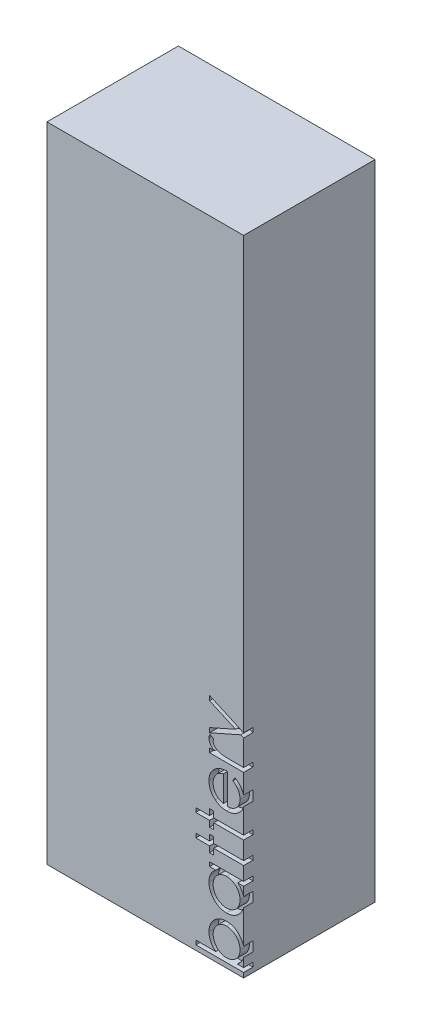
from build123d import *

# Parameters (mm, degrees)
SKETCH_1_W          = 42.2
SKETCH_1_H          = 138
EXTRUDE_1_DEPTH     = 28.2
CUT_EXTRUDE_1_DEPTH = 2


with BuildPart() as part:
    # 草图1 → 凸台-拉伸1 (new body)
    with BuildSketch(Plane.XY):
        with Locations((21.1, -69)):
            Rectangle(SKETCH_1_W, SKETCH_1_H)
    extrude(amount=EXTRUDE_1_DEPTH)

    # 草图2 → 切除-拉伸1 (cut)
    # profile 1 of 7: a face of its own
    with BuildSketch(Plane.XY.offset(28.2)):
        with BuildLine():
            Line((42.2, -136.974358974), (31.943589744, -136.974358974))
            Line((31.943589744, -136.974358974), (31.943589744, -136.076923077))
            Line((31.943589744, -136.076923077), (36.218429487, -136.076923077))
            add(Edge.make_bspline(
                [(36.218429487, -136.076923077), (36.101978253, -135.975799023), (35.874777095, -135.778501824), (35.578069524, -135.447711964), (35.326491018, -135.100838908), (35.119102108, -134.735243891), (34.961177516, -134.350406939), (34.845684974, -133.9483152), (34.776008108, -133.527940798), (34.768105042, -133.241314587), (34.764102564, -133.096153846)],
                knots=[0, 0, 0, 0, 1.077089805, 2.101446609, 3.097517232, 4.067117542, 5.031729543, 5.997785507, 6.985986182, 8, 8, 8, 8], degree=3))
            add(Edge.make_bspline(
                [(34.764102564, -133.096153846), (34.767646073, -132.967107738), (34.774652195, -132.71196159), (34.82789361, -132.336869741), (34.914230187, -131.975974669), (35.033922128, -131.629472818), (35.192730634, -131.298981011), (35.382848656, -130.981669419), (35.609243883, -130.679163749), (35.868096199, -130.396149791), (36.149115121, -130.135310116), (36.449630308, -129.906988658), (36.765273423, -129.714132384), (37.094987887, -129.554614404), (37.440120319, -129.431268539), (37.800332315, -129.346290633), (38.175269511, -129.292309306), (38.43044895, -129.285508603), (38.560176282, -129.282051282)],
                knots=[0, 0, 0, 0, 1.034377878, 2.045141349, 3.03070803, 4.00595497, 4.978199603, 5.965204761, 6.967410914, 8.002051993, 9.036360596, 10.037508045, 11.022711142, 11.997267194, 12.969246472, 13.954813154, 14.960274251, 16, 16, 16, 16], degree=3))
            add(Edge.make_bspline(
                [(38.560176282, -129.282051282), (38.687890618, -129.285583969), (38.939723176, -129.292549872), (39.310313337, -129.34575361), (39.666995335, -129.43360008), (40.008847498, -129.559203461), (40.337475822, -129.717103286), (40.64913412, -129.914564073), (40.949245479, -130.1425955), (41.22817014, -130.406398782), (41.485979854, -130.691866076), (41.709996612, -130.997335341), (41.903474098, -131.31511226), (42.056775377, -131.650149724), (42.180778009, -131.997486985), (42.266828554, -132.360845233), (42.317037283, -132.738168742), (42.324453189, -132.994508423), (42.328205128, -133.124198718)],
                knots=[0, 0, 0, 0, 1.024244038, 2.01964794, 2.996620209, 3.965911562, 4.936179293, 5.91563013, 6.920572822, 7.955171681, 8.990768464, 10.002129126, 10.989675881, 11.969873457, 12.952483066, 13.943799762, 14.959703725, 16, 16, 16, 16], degree=3))
            add(Edge.make_bspline(
                [(42.328205128, -133.124198718), (42.324093651, -133.272673277), (42.316031762, -133.563805999), (42.249056121, -133.989631041), (42.135400549, -134.392866234), (41.981626801, -134.77693392), (41.777676707, -135.140257955), (41.517461554, -135.477191695), (41.208918329, -135.796405709), (40.970515778, -135.98161598), (40.847836538, -136.076923077)],
                knots=[0, 0, 0, 0, 1.035695465, 2.030818224, 2.998575751, 3.95383478, 4.911511342, 5.895642538, 6.9171216, 8, 8, 8, 8], degree=3))
            Line((40.847836538, -136.076923077), (42.2, -136.076923077))
            Line((42.2, -136.076923077), (42.2, -136.974358974))
        make_face()
        with BuildLine():
            add(Edge.make_bspline(
                [(41.430769231, -133.132211538), (41.426101744, -133.001027638), (41.416888868, -132.742091486), (41.344963877, -132.361966886), (41.225296308, -131.998210064), (41.061623577, -131.652665687), (40.855864848, -131.330697775), (40.606807319, -131.043218757), (40.322361878, -130.786814473), (40.000172326, -130.574750825), (39.659163296, -130.396526075), (39.301053536, -130.273436098), (38.934457371, -130.191793557), (38.685480229, -130.183607178), (38.560176282, -130.179487179)],
                knots=[0, 0, 0, 0, 1.031962048, 2.036928941, 3.03239735, 4.0385178, 5.038525809, 6.02978215, 7.023528966, 8.042360763, 9.057703282, 10.043301522, 11.015242763, 12, 12, 12, 12], degree=3))
            add(Edge.make_bspline(
                [(38.560176282, -130.179487179), (38.434989019, -130.184880733), (38.185114274, -130.195646309), (37.814686654, -130.27100283), (37.455864869, -130.402596516), (37.109642044, -130.57721944), (36.786762615, -130.793985112), (36.496790823, -131.048287865), (36.246619439, -131.339378739), (36.038076379, -131.661731366), (35.867906227, -132.00510334), (35.751206155, -132.36650515), (35.674811334, -132.738385501), (35.665985253, -132.990944052), (35.661538462, -133.118189103)],
                knots=[0, 0, 0, 0, 0.984795267, 1.965658976, 2.959410029, 3.983795688, 5.009594896, 6.01088574, 7.009236619, 8.019050059, 9.024672985, 10.014834719, 10.999826153, 12, 12, 12, 12], degree=3))
            add(Edge.make_bspline(
                [(35.661538462, -133.118189103), (35.665982766, -133.248096229), (35.674803809, -133.505935516), (35.751340063, -133.886416706), (35.86862044, -134.258023951), (36.036990047, -134.613139342), (36.243043641, -134.944120969), (36.485083864, -135.240264247), (36.761463545, -135.494731084), (37.069934244, -135.706096371), (37.405055237, -135.872789238), (37.763104913, -135.991449072), (38.141308678, -136.063278144), (38.400272005, -136.072319423), (38.53213141, -136.076923077)],
                knots=[0, 0, 0, 0, 1.016765477, 2.018073157, 3.028859871, 4.063195613, 5.087896313, 6.076497715, 7.050163923, 8.020860621, 8.996393961, 9.972376003, 10.967570821, 12, 12, 12, 12], degree=3))
            add(Edge.make_bspline(
                [(38.53213141, -136.076923077), (38.633096973, -136.074181768), (38.831829152, -136.068786005), (39.123617305, -136.027547708), (39.402873924, -135.961991852), (39.669789704, -135.869466325), (39.922752821, -135.748709818), (40.162747916, -135.601154746), (40.389933266, -135.427724182), (40.602936145, -135.230860748), (40.796323951, -135.013099222), (40.966753454, -134.781498286), (41.110989022, -134.53668844), (41.226413869, -134.278828989), (41.32044796, -134.009909276), (41.382555767, -133.72735087), (41.425338485, -133.434001684), (41.428939922, -133.233867432), (41.430769231, -133.132211538)],
                knots=[0, 0, 0, 0, 1.050451894, 2.067621751, 3.060405293, 4.031799135, 5.001600853, 5.971751072, 6.958557977, 7.97156518, 8.985525354, 9.984878154, 10.959795236, 11.936345554, 12.920874276, 13.918848941, 14.942903235, 16, 16, 16, 16], degree=3))
        make_face(mode=Mode.SUBTRACT)
    # profile 2 of 7: a face of its own
    with BuildSketch(Plane.XY.offset(28.2)):
        with BuildLine():
            Line((34.892307692, -120.051282051), (42.2, -120.051282051))
            Line((42.2, -120.051282051), (42.2, -120.948717949))
            Line((42.2, -120.948717949), (40.935977564, -120.948717949))
            add(Edge.make_bspline(
                [(40.935977564, -120.948717949), (41.050187905, -121.050072478), (41.273402273, -121.248161258), (41.56769023, -121.575889304), (41.80598271, -121.927599507), (42.001234525, -122.294466425), (42.147308474, -122.680083612), (42.251319993, -123.082435569), (42.318145616, -123.501906696), (42.324821874, -123.788340617), (42.328205128, -123.93349359)],
                knots=[0, 0, 0, 0, 1.074325654, 2.099677833, 3.090439787, 4.057542011, 5.018572219, 5.985274637, 6.979019747, 8, 8, 8, 8], degree=3))
            add(Edge.make_bspline(
                [(42.328205128, -123.93349359), (42.324701207, -124.062544886), (42.317791321, -124.317039758), (42.264184739, -124.691408549), (42.178097248, -125.051672119), (42.058380421, -125.398170898), (41.899578074, -125.728662742), (41.709460222, -126.045977304), (41.48305785, -126.34847071), (41.224234912, -126.63153225), (40.943106378, -126.892195108), (40.643261958, -127.120941601), (40.325998232, -127.311664687), (39.995332079, -127.471150632), (39.648718023, -127.59399733), (39.287354686, -127.679636285), (38.911669333, -127.733180418), (38.655842124, -127.740087449), (38.526121795, -127.743589744)],
                knots=[0, 0, 0, 0, 1.033919861, 2.038935746, 3.024066025, 3.998881131, 4.97069526, 5.957263378, 6.95902576, 7.993208707, 9.027059324, 10.027763471, 11.009749337, 11.988697705, 12.965288445, 13.950418724, 14.960734635, 16, 16, 16, 16], degree=3))
            add(Edge.make_bspline(
                [(38.526121795, -127.743589744), (38.399082642, -127.740009825), (38.147933089, -127.73293252), (37.778565381, -127.680209035), (37.422798922, -127.59154901), (37.081779084, -127.467126588), (36.755093226, -127.307578145), (36.442510298, -127.113497897), (36.143169162, -126.884871826), (35.864108514, -126.62129352), (35.60633533, -126.335765606), (35.382309486, -126.030312089), (35.188832775, -125.712531285), (35.035537129, -125.377494112), (34.911511116, -125.030159527), (34.825702636, -124.667435396), (34.775138861, -124.290830886), (34.767816677, -124.035143766), (34.764102564, -123.905448718)],
                knots=[0, 0, 0, 0, 1.020392517, 2.01726096, 2.990465484, 3.961182959, 4.928053699, 5.906110375, 6.912531644, 7.948652711, 8.985773172, 9.998621852, 10.987621588, 11.969261332, 12.953316658, 13.946091881, 14.958173133, 16, 16, 16, 16], degree=3))
            add(Edge.make_bspline(
                [(34.764102564, -123.905448718), (34.768215001, -123.756309088), (34.776279297, -123.463853313), (34.843250967, -123.036019063), (34.956739663, -122.631466206), (35.110049026, -122.245900025), (35.318038479, -121.884627737), (35.573067597, -121.543152039), (35.885680187, -121.228737851), (36.122805298, -121.043672572), (36.244471154, -120.948717949)],
                knots=[0, 0, 0, 0, 1.039007978, 2.037445607, 3.008437381, 3.96246474, 4.921201921, 5.904967172, 6.925065498, 8, 8, 8, 8], degree=3))
            Line((36.244471154, -120.948717949), (34.892307692, -120.948717949))
            Line((34.892307692, -120.948717949), (34.892307692, -120.051282051))
        make_face()
        with BuildLine():
            add(Edge.make_bspline(
                [(35.661538462, -123.893429487), (35.666209993, -124.024610486), (35.675430852, -124.283540914), (35.747297353, -124.663707462), (35.867184708, -125.027306653), (36.030185616, -125.373773086), (36.239036297, -125.693445323), (36.485100962, -125.984158), (36.772533088, -126.236947311), (37.091046304, -126.454345507), (37.43439572, -126.628867643), (37.793198352, -126.752365554), (38.161244672, -126.833664042), (38.41084806, -126.841979738), (38.536137821, -126.846153846)],
                knots=[0, 0, 0, 0, 1.031130969, 2.035288524, 3.029955243, 4.035265425, 5.037320146, 6.024362013, 7.021230137, 8.037832003, 9.049975902, 10.039737725, 11.016035826, 12, 12, 12, 12], degree=3))
            add(Edge.make_bspline(
                [(38.536137821, -126.846153846), (38.660673118, -126.840804077), (38.909255577, -126.830125508), (39.277270306, -126.754145524), (39.63526753, -126.625004028), (39.981376055, -126.450717884), (40.3030015, -126.230761077), (40.595596238, -125.978212185), (40.845509896, -125.686100815), (41.054864067, -125.363570503), (41.223871984, -125.018944225), (41.341495407, -124.656569982), (41.417430007, -124.283208809), (41.426300199, -124.029345295), (41.430769231, -123.901442308)],
                knots=[0, 0, 0, 0, 0.979154007, 1.954470061, 2.941101473, 3.965068436, 4.993389179, 5.998216918, 6.996159742, 8.005560442, 9.015493761, 10.005250788, 10.994993882, 12, 12, 12, 12], degree=3))
            add(Edge.make_bspline(
                [(41.430769231, -123.901442308), (41.425971686, -123.771612849), (41.416429846, -123.513394933), (41.344969941, -123.131675998), (41.222429065, -122.762504678), (41.057746804, -122.408399304), (40.852630809, -122.078842809), (40.612495389, -121.784063876), (40.33514011, -121.531857814), (40.026782175, -121.321877812), (39.690885093, -121.155353411), (39.333629972, -121.033592897), (38.95429166, -120.962402756), (38.694690792, -120.953342625), (38.562179487, -120.948717949)],
                knots=[0, 0, 0, 0, 1.01787422, 2.024450869, 3.03297362, 4.061474925, 5.080076323, 6.069755756, 7.033548292, 8.009625779, 8.9862229, 9.964937832, 10.961217871, 12, 12, 12, 12], degree=3))
            add(Edge.make_bspline(
                [(38.562179487, -120.948717949), (38.461214257, -120.951459824), (38.262482733, -120.956856702), (37.970689826, -120.998086901), (37.691450609, -121.063672405), (37.424471497, -121.156090034), (37.171228596, -121.277493704), (36.929903567, -121.423915892), (36.701751534, -121.597931462), (36.489914189, -121.796739166), (36.296695725, -122.01435403), (36.124226466, -122.244624146), (35.982544258, -122.490277709), (35.865283482, -122.747183529), (35.771971625, -123.015787341), (35.709721072, -123.298274827), (35.666977297, -123.591643361), (35.663370495, -123.791774947), (35.661538462, -123.893429487)],
                knots=[0, 0, 0, 0, 1.050140795, 2.067009409, 3.05949893, 4.030605086, 5.00011959, 5.97591094, 6.962425594, 7.979863591, 8.993523472, 9.986985069, 10.967611495, 11.937549037, 12.921786183, 13.919465291, 14.943216303, 16, 16, 16, 16], degree=3))
        make_face(mode=Mode.SUBTRACT)
    # profile 3 of 7: a face of its own
    with BuildSketch(Plane.XY.offset(28.2)):
        Polygon((31.943589744, -117.102564103), (31.943589744, -116.205128205), (34.892307692, -116.205128205), (34.892307692, -114.923076923), (35.78974359, -114.923076923), (35.78974359, -116.205128205), (42.2, -116.205128205), (42.2, -117.102564103), (35.78974359, -117.102564103), (35.78974359, -118.384615385), (34.892307692, -118.384615385), (34.892307692, -117.102564103), align=None)
    # profile 4 of 7: a face of its own
    with BuildSketch(Plane.XY.offset(28.2)):
        Polygon((31.943589744, -112.358974359), (31.943589744, -111.461538462), (34.892307692, -111.461538462), (34.892307692, -110.179487179), (35.78974359, -110.179487179), (35.78974359, -111.461538462), (42.2, -111.461538462), (42.2, -112.358974359), (35.78974359, -112.358974359), (35.78974359, -113.641025641), (34.892307692, -113.641025641), (34.892307692, -112.358974359), align=None)
    # profile 5 of 7: a face of its own
    with BuildSketch(Plane.XY.offset(28.2)):
        with BuildLine():
            Line((39.892307692, -102.515224359), (40.310977564, -101.717948718))
            add(Edge.make_bspline(
                [(40.310977564, -101.717948718), (40.423646082, -101.781515178), (40.6428544, -101.905190337), (40.944037168, -102.117010115), (41.213372981, -102.34109145), (41.446548999, -102.584252244), (41.652472377, -102.839165035), (41.830092806, -103.110671408), (41.9826152, -103.396555224), (42.107593069, -103.69996535), (42.205845295, -104.020538331), (42.278405234, -104.360134358), (42.320483103, -104.720356878), (42.325590092, -104.967036772), (42.328205128, -105.093349359)],
                knots=[0, 0, 0, 0, 1.120611642, 2.180266485, 3.186550691, 4.152466804, 5.095166165, 6.022949561, 6.960161436, 7.899497276, 8.862391909, 9.862399089, 10.905440174, 12, 12, 12, 12], degree=3))
            add(Edge.make_bspline(
                [(42.328205128, -105.093349359), (42.324927484, -105.233755009), (42.318533751, -105.507645756), (42.263412425, -105.906330751), (42.173491395, -106.281700506), (42.047875579, -106.633733986), (41.88379745, -106.961568843), (41.683913442, -107.265857559), (41.449249, -107.548196942), (41.177776702, -107.799702728), (40.887244749, -108.026083973), (40.584557295, -108.225979916), (40.270762579, -108.392321999), (39.947727611, -108.529699083), (39.616186456, -108.63806357), (39.274240338, -108.715069045), (38.923245174, -108.759049469), (38.685829149, -108.765819224), (38.566185897, -108.769230769)],
                knots=[0, 0, 0, 0, 1.14524686, 2.234044844, 3.276713788, 4.290115724, 5.276966211, 6.260758605, 7.254862358, 8.264742877, 9.274005885, 10.257798278, 11.220590477, 12.167824544, 13.118936889, 14.062732937, 15.023735098, 16, 16, 16, 16], degree=3))
            add(Edge.make_bspline(
                [(38.566185897, -108.769230769), (38.453914953, -108.766204651), (38.231408769, -108.760207285), (37.902078641, -108.722405035), (37.581997348, -108.655409912), (37.270898926, -108.563477558), (36.969304257, -108.444759712), (36.67702979, -108.2995248), (36.394386533, -108.127546577), (36.216091865, -107.994767509), (36.126282051, -107.927884615)],
                knots=[0, 0, 0, 0, 1.024358464, 2.0301432, 3.019427413, 4.004406732, 4.986367066, 5.972626655, 6.978780325, 8, 8, 8, 8], degree=3))
            add(Edge.make_bspline(
                [(36.126282051, -107.927884615), (36.017905883, -107.837447418), (35.804934749, -107.659728341), (35.527649538, -107.356023311), (35.290455745, -107.031595368), (35.096952579, -106.683181156), (34.94811805, -106.311367559), (34.842254018, -105.918072364), (34.776380582, -105.502208512), (34.76825746, -105.217129292), (34.764102564, -105.071314103)],
                knots=[0, 0, 0, 0, 1.030811313, 2.025658015, 2.997072178, 3.962767568, 4.930766827, 5.917075773, 6.934604948, 8, 8, 8, 8], degree=3))
            add(Edge.make_bspline(
                [(34.764102564, -105.071314103), (34.767951899, -104.921455185), (34.775503417, -104.62746615), (34.846138136, -104.19892469), (34.956791667, -103.79263353), (35.118008608, -103.411945582), (35.317848019, -103.050995007), (35.570435676, -102.718089041), (35.862798381, -102.404089199), (36.087872114, -102.221512385), (36.202403846, -102.128605769)],
                knots=[0, 0, 0, 0, 1.056389096, 2.072394598, 3.055233004, 4.020130009, 4.981825462, 5.957811105, 6.960805292, 8, 8, 8, 8], degree=3))
            add(Edge.make_bspline(
                [(36.202403846, -102.128605769), (36.288699793, -102.065385945), (36.460717275, -101.939367108), (36.741206295, -101.781518251), (37.034665136, -101.644497122), (37.345837414, -101.534974377), (37.671036214, -101.446290087), (38.012586342, -101.382127748), (38.370386089, -101.344500266), (38.614176247, -101.337103988), (38.738461538, -101.333333333)],
                knots=[0, 0, 0, 0, 0.94817472, 1.890038105, 2.849395472, 3.817997239, 4.812318967, 5.836947057, 6.897266129, 8, 8, 8, 8], degree=3))
            Line((38.738461538, -101.333333333), (38.738461538, -107.871794872))
            add(Edge.make_bspline(
                [(38.738461538, -107.871794872), (38.834748579, -107.867395996), (39.024093161, -107.858745785), (39.301152542, -107.818416805), (39.565076376, -107.754848879), (39.813885068, -107.6655087), (40.050828289, -107.557317714), (40.274148395, -107.424787095), (40.482828195, -107.266674083), (40.678734302, -107.090314942), (40.85319362, -106.894008956), (41.009341552, -106.687486821), (41.140214686, -106.467790921), (41.246442942, -106.236653539), (41.329603845, -105.994448439), (41.386369047, -105.74109931), (41.424389352, -105.477104692), (41.428616967, -105.297145452), (41.430769231, -105.205528846)],
                knots=[0, 0, 0, 0, 1.094153842, 2.151609401, 3.174256925, 4.172055639, 5.149267565, 6.128595816, 7.11444997, 8.118368179, 9.117203808, 10.09244225, 11.054858984, 12.015122123, 12.976791628, 13.957293641, 14.960065497, 16, 16, 16, 16], degree=3))
            add(Edge.make_bspline(
                [(41.430769231, -105.205528846), (41.429045916, -105.11595023), (41.425626529, -104.938209073), (41.391900701, -104.673578482), (41.338448192, -104.412776138), (41.261460321, -104.158391738), (41.171308563, -103.914132616), (41.065200525, -103.686685707), (40.944225352, -103.479057973), (40.80675222, -103.284245586), (40.638036583, -103.096310138), (40.429518801, -102.906925825), (40.178833862, -102.708338041), (39.991410499, -102.582017937), (39.892307692, -102.515224359)],
                knots=[0, 0, 0, 0, 0.991168677, 1.966668791, 2.94808785, 3.9350306, 4.905702032, 5.828266021, 6.709360349, 7.562606342, 8.463112863, 9.498839253, 10.677475166, 12, 12, 12, 12], degree=3))
        make_face()
        with BuildLine():
            add(Edge.make_bspline(
                [(37.841025641, -102.230769231), (37.721929373, -102.263483711), (37.49330323, -102.326284885), (37.176821916, -102.460030898), (36.893931127, -102.607025325), (36.649331879, -102.78397769), (36.431747227, -102.982511455), (36.244642731, -103.214999294), (36.072192103, -103.471357943), (35.928581784, -103.756693548), (35.81056867, -104.059753894), (35.72379255, -104.374309897), (35.672782947, -104.69772686), (35.665304243, -104.915556022), (35.661538462, -105.025240385)],
                knots=[0, 0, 0, 0, 1.155085888, 2.217389643, 3.210301801, 4.133263417, 5.03575695, 5.95948047, 6.920061569, 7.923798377, 8.943125483, 9.960783337, 10.973185325, 12, 12, 12, 12], degree=3))
            add(Edge.make_bspline(
                [(35.661538462, -105.025240385), (35.663265715, -105.114817054), (35.666680133, -105.291891295), (35.699746377, -105.552652598), (35.752880159, -105.803724976), (35.831005204, -106.044358994), (35.926067945, -106.276150861), (36.042919288, -106.498933092), (36.184194606, -106.70984178), (36.292114083, -106.841659412), (36.346634615, -106.908253205)],
                knots=[0, 0, 0, 0, 1.048823158, 2.073302879, 3.073550078, 4.050623576, 5.03253758, 6.005186856, 6.992227572, 8, 8, 8, 8], degree=3))
            add(Edge.make_bspline(
                [(36.346634615, -106.908253205), (36.389756699, -106.955955771), (36.477025285, -107.052494139), (36.627465195, -107.18135039), (36.78978105, -107.30564579), (36.971058086, -107.416100363), (37.166039466, -107.521071039), (37.376147921, -107.616726541), (37.602270323, -107.703700953), (37.759918073, -107.75252496), (37.841025641, -107.777644231)],
                knots=[0, 0, 0, 0, 0.879905587, 1.780714457, 2.708106151, 3.677566983, 4.684151534, 5.740052498, 6.837288539, 8, 8, 8, 8], degree=3))
            Line((37.841025641, -107.777644231), (37.841025641, -102.230769231))
        make_face(mode=Mode.SUBTRACT)
    # profile 6 of 7: a face of its own
    with BuildSketch(Plane.XY.offset(28.2)):
        with BuildLine():
            Line((34.892307692, -99.794871795), (34.892307692, -98.897435897))
            Line((34.892307692, -98.897435897), (35.968028846, -98.897435897))
            add(Edge.make_bspline(
                [(35.968028846, -98.897435897), (35.867824498, -98.831224693), (35.676184459, -98.704596279), (35.423068406, -98.493139657), (35.211105109, -98.278855159), (35.04433674, -98.056116069), (34.918300577, -97.827106169), (34.829738914, -97.593756578), (34.774819131, -97.355496673), (34.767679538, -97.194995352), (34.764102564, -97.114583333)],
                knots=[0, 0, 0, 0, 1.280091057, 2.448164201, 3.510831157, 4.48793739, 5.405868014, 6.289422536, 7.142991551, 8, 8, 8, 8], degree=3))
            add(Edge.make_bspline(
                [(34.764102564, -97.114583333), (34.767504069, -97.052222401), (34.774502885, -96.923910728), (34.82367667, -96.729674758), (34.902185306, -96.529550609), (34.976014514, -96.40057236), (35.014503205, -96.333333333)],
                knots=[0, 0, 0, 0, 0.901110191, 1.854092781, 2.881294221, 4, 4, 4, 4], degree=3))
            Line((35.014503205, -96.333333333), (35.791746795, -96.826121795))
            add(Edge.make_bspline(
                [(35.791746795, -96.826121795), (35.772488892, -96.869290427), (35.735933705, -96.951232754), (35.692670819, -97.071102943), (35.667196773, -97.181621048), (35.663337581, -97.252031215), (35.661538462, -97.284855769)],
                knots=[0, 0, 0, 0, 1.180555205, 2.24091978, 3.179933427, 4, 4, 4, 4], degree=3))
            add(Edge.make_bspline(
                [(35.661538462, -97.284855769), (35.666300978, -97.356893773), (35.67601513, -97.503830418), (35.753474174, -97.718834229), (35.875025084, -97.9293353), (36.013435634, -98.094901682), (36.146391071, -98.223549866), (36.262756398, -98.316070375), (36.39444441, -98.39910891), (36.536365074, -98.479658494), (36.692080193, -98.554495139), (36.861843798, -98.621372674), (37.044254045, -98.683916045), (37.171088142, -98.719137589), (37.236057692, -98.737179487)],
                knots=[0, 0, 0, 0, 1.125322384, 2.295331465, 3.535939348, 4.916963136, 5.656144286, 6.429838446, 7.238666481, 8.090384391, 8.983239461, 9.940052224, 10.944811494, 12, 12, 12, 12], degree=3))
            add(Edge.make_bspline(
                [(37.236057692, -98.737179487), (37.293989267, -98.750723979), (37.422946761, -98.78087444), (37.63831076, -98.809406991), (37.892592552, -98.838733801), (38.186087535, -98.858761059), (38.519923911, -98.877679476), (38.892661509, -98.888130789), (39.305324805, -98.897103373), (39.593155834, -98.89732152), (39.744070513, -98.897435897)],
                knots=[0, 0, 0, 0, 0.566841273, 1.261806378, 2.068780918, 3.007109044, 4.065315289, 5.256255371, 6.561408263, 8, 8, 8, 8], degree=3))
            Line((39.744070513, -98.897435897), (42.2, -98.897435897))
            Line((42.2, -98.897435897), (42.2, -99.794871795))
            Line((42.2, -99.794871795), (34.892307692, -99.794871795))
        make_face()
    # profile 7 of 7: a face of its own
    with BuildSketch(Plane.XY.offset(28.2)):
        Polygon((34.892307692, -96.076923077), (34.892307692, -95.109375), (40.489262821, -92.635416667), (34.892307692, -90.123397436), (34.892307692, -89.153846154), (44.892307692, -93.641025641), (44.892307692, -94.610576923), (41.577003205, -93.122195513), align=None)
    extrude(amount=-CUT_EXTRUDE_1_DEPTH, mode=Mode.SUBTRACT)


solid = part.part
